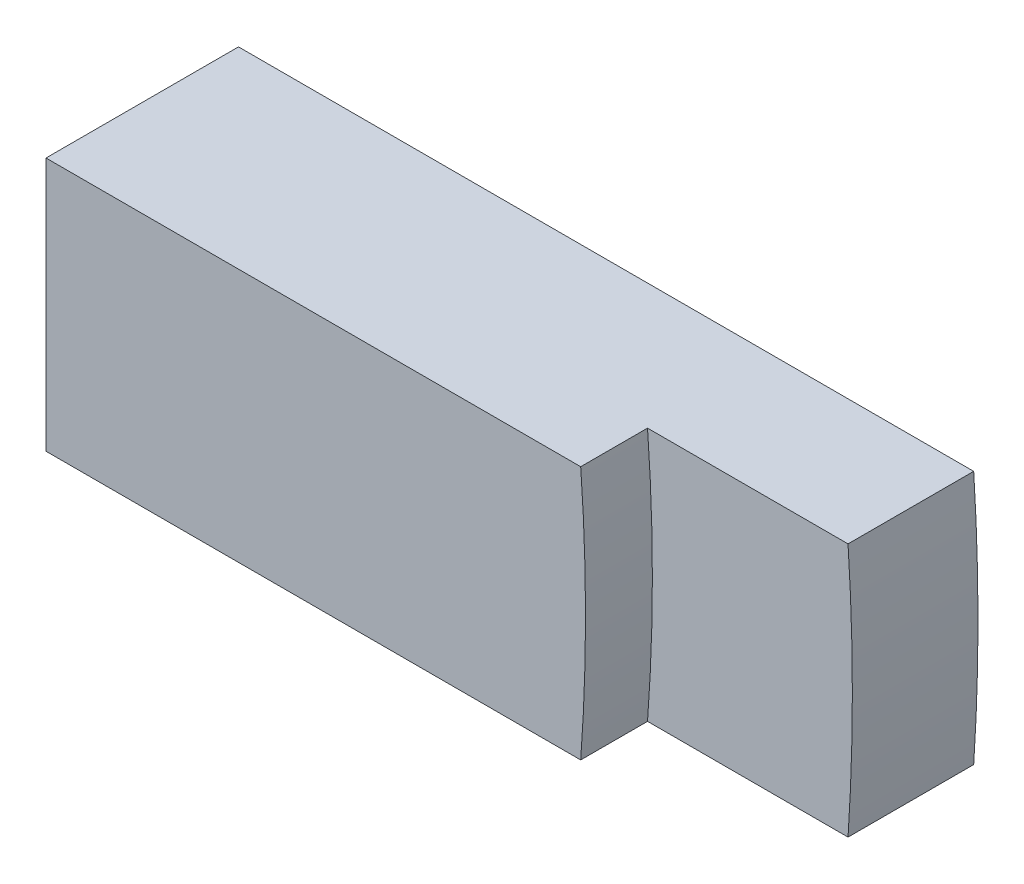
from build123d import *

# Parameters (mm, degrees)
BOSS_EXTRUDE1_DEPTH = 1.8288
BOSS_EXTRUDE2_DEPTH = 1.1938


with BuildPart() as part:
    # Sketch2 → Boss-Extrude1 (new body)
    with BuildSketch(Plane.XY):
        with BuildLine():
            Line((-2.54, -1.2065), (2.54, -1.2065))
            ThreePointArc((2.54, -1.2065), (2.585913395, 0), (2.54, 1.2065))
            Line((2.54, 1.2065), (-2.54, 1.2065))
            Line((-2.54, 1.2065), (-2.54, -1.2065))
        make_face()
    extrude(amount=BOSS_EXTRUDE1_DEPTH)

    # Sketch3 → Boss-Extrude2 (add)
    with BuildSketch(Plane.XY):
        with BuildLine():
            Line((2.54, 1.2065), (4.445, 1.2065))
            ThreePointArc((4.445, 1.2065), (4.485982052, 0), (4.445, -1.2065))
            Line((4.445, -1.2065), (2.54, -1.2065))
            Line((2.54, -1.2065), (2.54, 1.2065))
        make_face()
    extrude(amount=BOSS_EXTRUDE2_DEPTH)


solid = part.part
